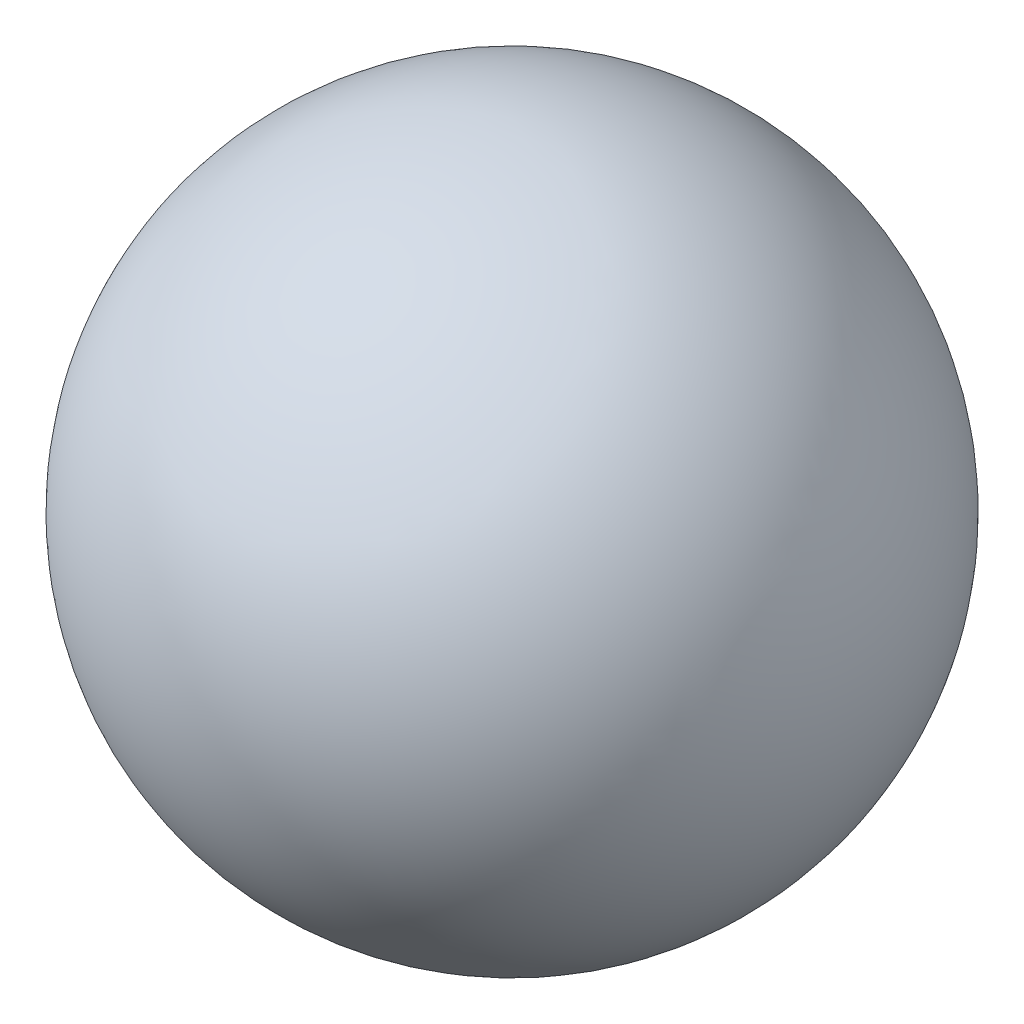
from build123d import *


with BuildPart() as part:
    # Sketch1 → Revolve1 (revolve)
    with BuildSketch(Plane.XY):
        with BuildLine():
            Line((0, 0), (2.2, 0))
            ThreePointArc((2.2, 0), (0, 2.2), (-2.2, 0))
            Line((-2.2, 0), (0, 0))
        make_face()
    revolve(axis=Axis((0, 0, 0), (-1, 0, 0)))


solid = part.part
